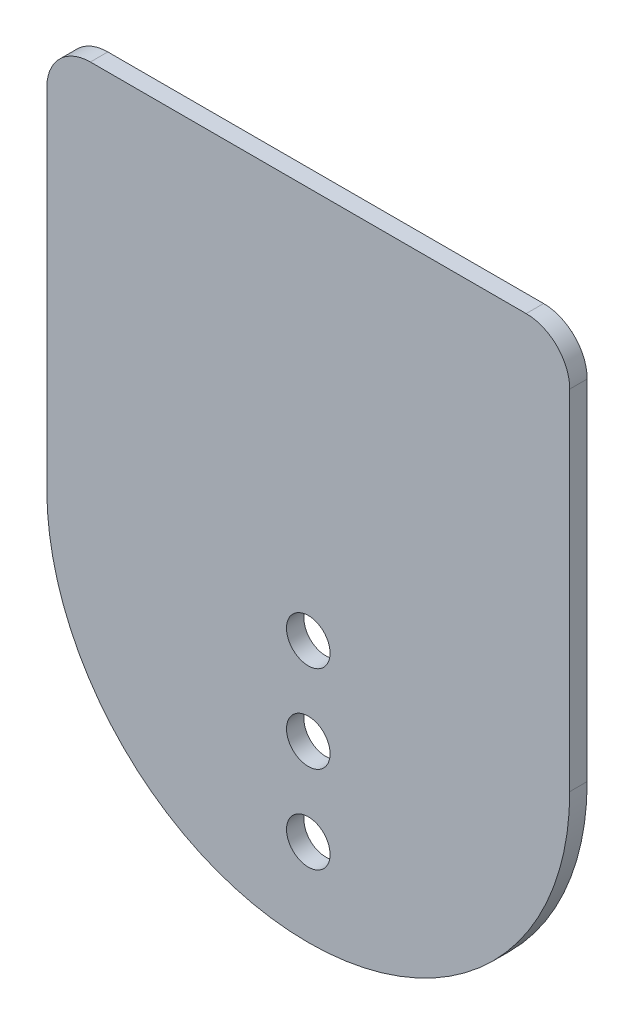
from build123d import *

# Parameters (mm, degrees)
SKETCH_1_R      = 5
EXTRUDE_1_DEPTH = 2


with BuildPart() as part:
    # 草图1 → 凸台-拉伸1 (new, symmetric)
    with BuildSketch(Plane.XY):
        with BuildLine():
            Line((10, 0), (110, 0))
            ThreePointArc((110, 0), (117.071067812, -2.928932188), (120, -10))
            Line((120, -10), (120, -90))
            ThreePointArc((120, -90), (102.426406871, -132.426406871), (60, -150))
            ThreePointArc((60, -150), (17.573593129, -132.426406871), (0, -90))
            Line((0, -90), (0, -10))
            ThreePointArc((0, -10), (2.928932188, -2.928932188), (10, 0))
        make_face()
        with Locations((60, -130)):
            Circle(SKETCH_1_R, mode=Mode.SUBTRACT)
        with Locations((60, -110)):
            Circle(SKETCH_1_R, mode=Mode.SUBTRACT)
        with Locations((60, -90)):
            Circle(SKETCH_1_R, mode=Mode.SUBTRACT)
    extrude(amount=EXTRUDE_1_DEPTH, both=True)


solid = part.part
